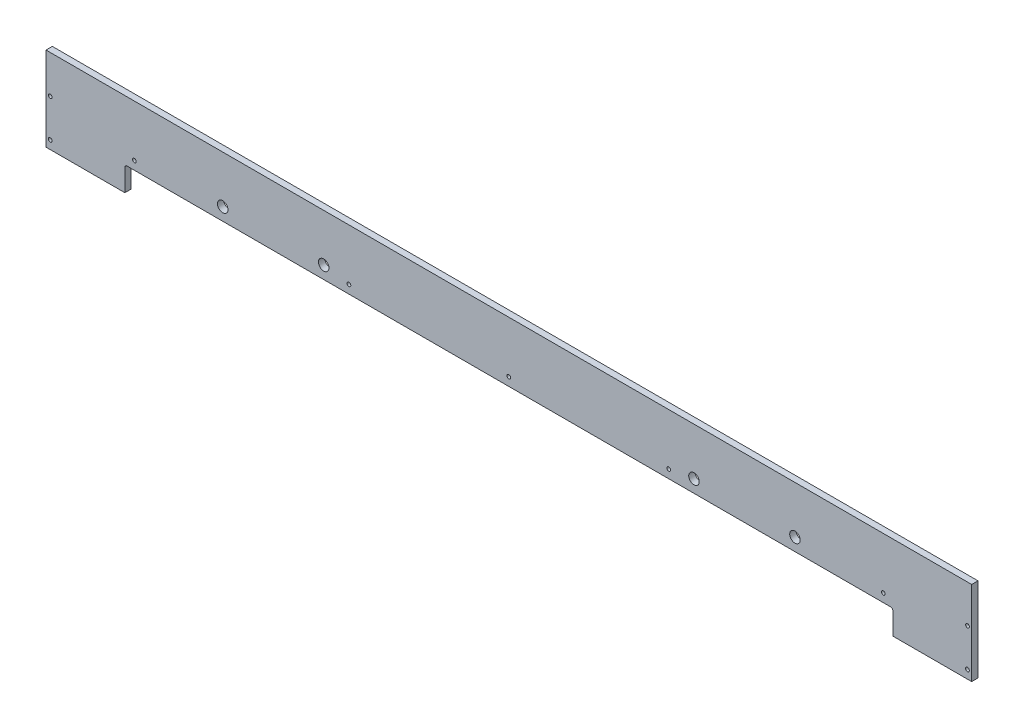
from build123d import *

# Parameters (mm, degrees)
SKETCH1_W              = 1397
SKETCH1_H              = 127
BOSS_EXTRUDE1_DEPTH    = 9.525
CUT_EXTRUDE1_DEPTH     = 702.445098083
F_10_CLEARANCE_HOLE1_D = 5.6134
CUT_EXTRUDE2_REACH     = 703.445
SKETCH8_R              = 7.9375


with BuildPart() as part:
    # Sketch1 → Boss-Extrude1 (new body)
    with BuildSketch(Plane.XY):
        Rectangle(SKETCH1_W, SKETCH1_H)
    extrude(amount=-BOSS_EXTRUDE1_DEPTH)

    # Sketch2 → Cut-Extrude1 (cut, through all)
    with BuildSketch(Plane.XY):
        with BuildLine():
            Line((-579.4375, -63.5), (579.4375, -63.5))
            Line((579.4375, -63.5), (579.4375, -30.1625))
            ThreePointArc((579.4375, -30.1625), (578.50756403, -27.91743597), (576.2625, -26.9875))
            Line((576.2625, -26.9875), (-576.2625, -26.9875))
            ThreePointArc((-576.2625, -26.9875), (-578.50756403, -27.91743597), (-579.4375, -30.1625))
            Line((-579.4375, -30.1625), (-579.4375, -63.5))
        make_face()
    extrude(amount=-CUT_EXTRUDE1_DEPTH, mode=Mode.SUBTRACT)

    # #10 Clearance Hole1 (through all)
    with Locations(Plane.XY):
        with Locations((-692.15, 6.35), (-692.15, -50.8), (692.15, 6.35), (692.15, -50.8), (-565.15, -14.2875), (-241.3, -14.2875), (0, -14.2875), (241.3, -14.2875), (565.15, -14.2875)):
            Hole(F_10_CLEARANCE_HOLE1_D / 2)

    # Sketch8 → Cut-Extrude2 (cut, up to next)
    with BuildSketch(Plane.XY, mode=Mode.PRIVATE) as cut_extrude2_sk1:
        with Locations((-431.8, -7.9375)):
            Circle(SKETCH8_R)
    cut_extrude2_tool1 = extrude(cut_extrude2_sk1.sketch, amount=-CUT_EXTRUDE2_REACH, mode=Mode.PRIVATE) & part.part
    # Sketch8 → Cut-Extrude2 (cut, up to next)
    with BuildSketch(Plane.XY, mode=Mode.PRIVATE) as cut_extrude2_sk2:
        with Locations((-279.4, -7.9375)):
            Circle(SKETCH8_R)
    cut_extrude2_tool2 = extrude(cut_extrude2_sk2.sketch, amount=-CUT_EXTRUDE2_REACH, mode=Mode.PRIVATE) & part.part
    # Sketch8 → Cut-Extrude2 (cut, up to next)
    with BuildSketch(Plane.XY, mode=Mode.PRIVATE) as cut_extrude2_sk3:
        with Locations((279.4, -7.9375)):
            Circle(SKETCH8_R)
    cut_extrude2_tool3 = extrude(cut_extrude2_sk3.sketch, amount=-CUT_EXTRUDE2_REACH, mode=Mode.PRIVATE) & part.part
    # Sketch8 → Cut-Extrude2 (cut, up to next)
    with BuildSketch(Plane.XY, mode=Mode.PRIVATE) as cut_extrude2_sk4:
        with Locations((431.8, -7.9375)):
            Circle(SKETCH8_R)
    cut_extrude2_tool4 = extrude(cut_extrude2_sk4.sketch, amount=-CUT_EXTRUDE2_REACH, mode=Mode.PRIVATE) & part.part
    add(cut_extrude2_tool1.solids().sort_by_distance((-431.8, -7.9375, 0))[0], mode=Mode.SUBTRACT)
    add(cut_extrude2_tool2.solids().sort_by_distance((-279.4, -7.9375, 0))[0], mode=Mode.SUBTRACT)
    add(cut_extrude2_tool3.solids().sort_by_distance((279.4, -7.9375, 0))[0], mode=Mode.SUBTRACT)
    add(cut_extrude2_tool4.solids().sort_by_distance((431.8, -7.9375, 0))[0], mode=Mode.SUBTRACT)


solid = part.part
